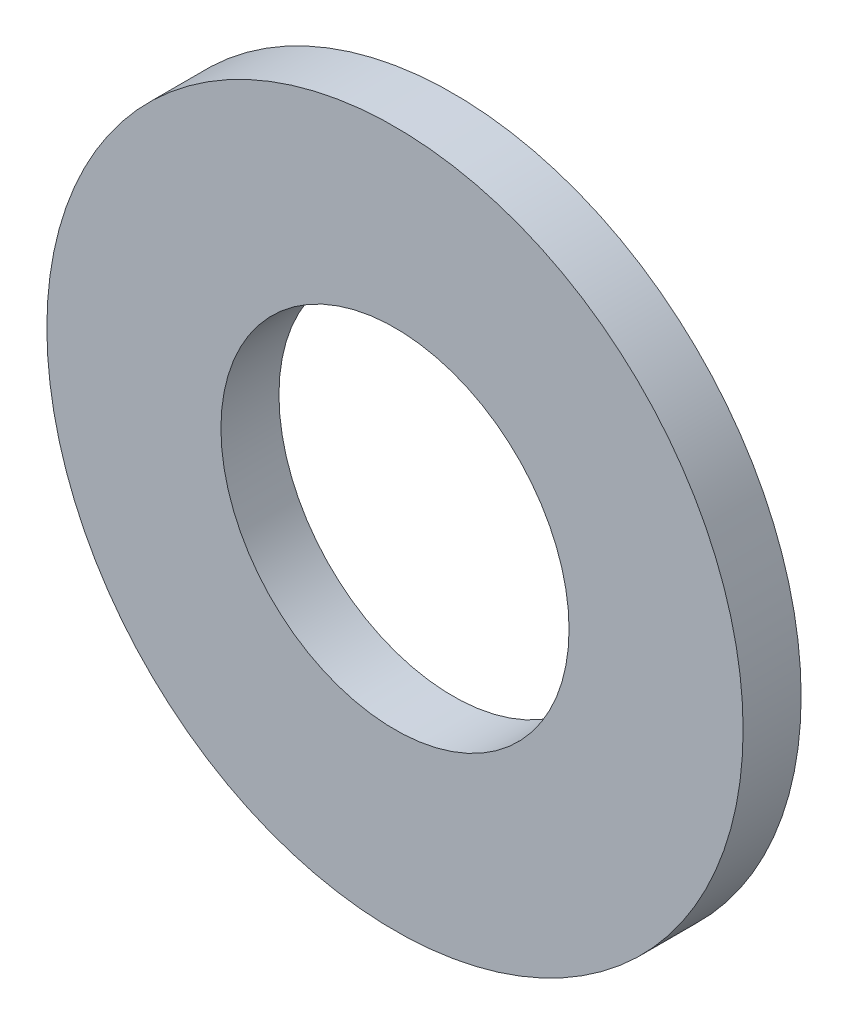
from build123d import *

# Parameters (mm, degrees)
SKETCH1_R           = 3
SKETCH1_R_2         = 1.5
BOSS_EXTRUDE1_DEPTH = 0.5


with BuildPart() as part:
    # Sketch1 → Boss-Extrude1 (new body)
    with BuildSketch(Plane.XY):
        Circle(SKETCH1_R)
        Circle(SKETCH1_R_2, mode=Mode.SUBTRACT)
    extrude(amount=BOSS_EXTRUDE1_DEPTH)


solid = part.part
